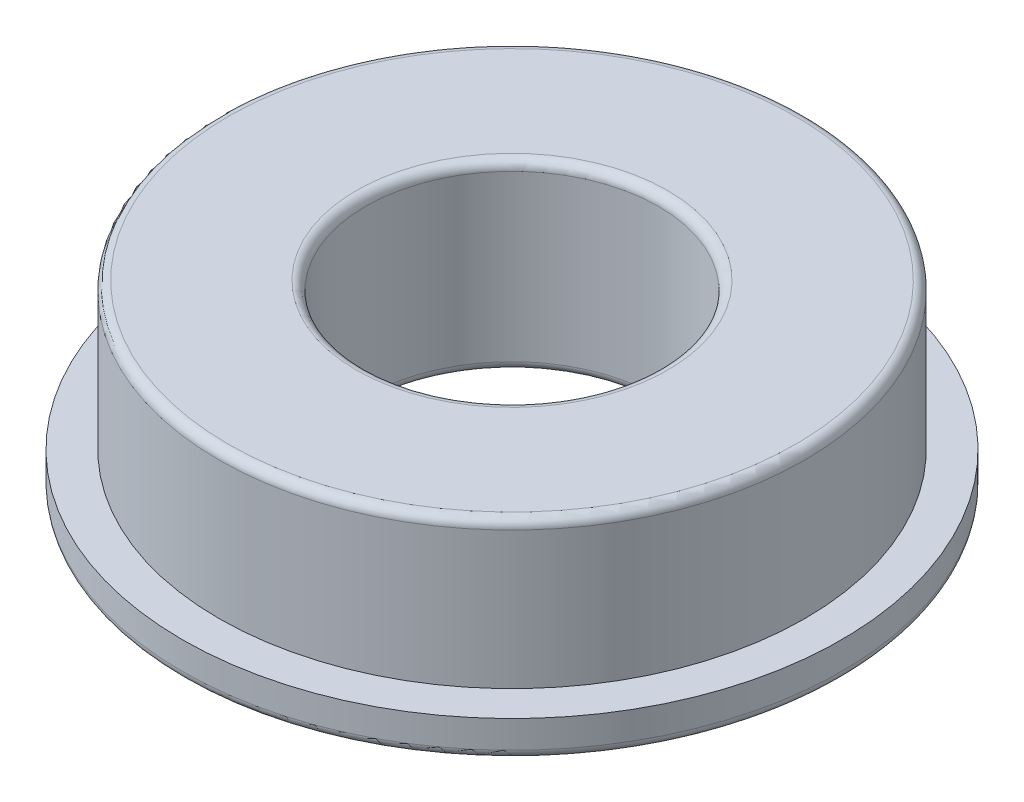
from build123d import *

# Parameters (mm, degrees)
CONG_1_R = 0.25


with BuildPart() as part:
    # Esquisse1 → Révolution1 (revolve)
    with BuildSketch(Plane.XY, mode=Mode.PRIVATE) as r_volution1_sk:
        Polygon((4, 5), (4, 0), (9, 0), (9, 1), (8, 1), (8, 5), align=None)
    revolve(r_volution1_sk.sketch.rotate(Axis((0, 0, 0), (0, 1, 0)), 90), axis=Axis((0, 0, 0), (0, 1, 0)))

    # Congé1
    cong_1_edges = [part.edges().sort_by_distance(p)[0] for p in [
        (0, 5, 8),
        (0, 0, 9),
        (0, 0, 4),
        (0, 5, 4),
    ]]
    fillet(cong_1_edges, radius=CONG_1_R)


solid = part.part
